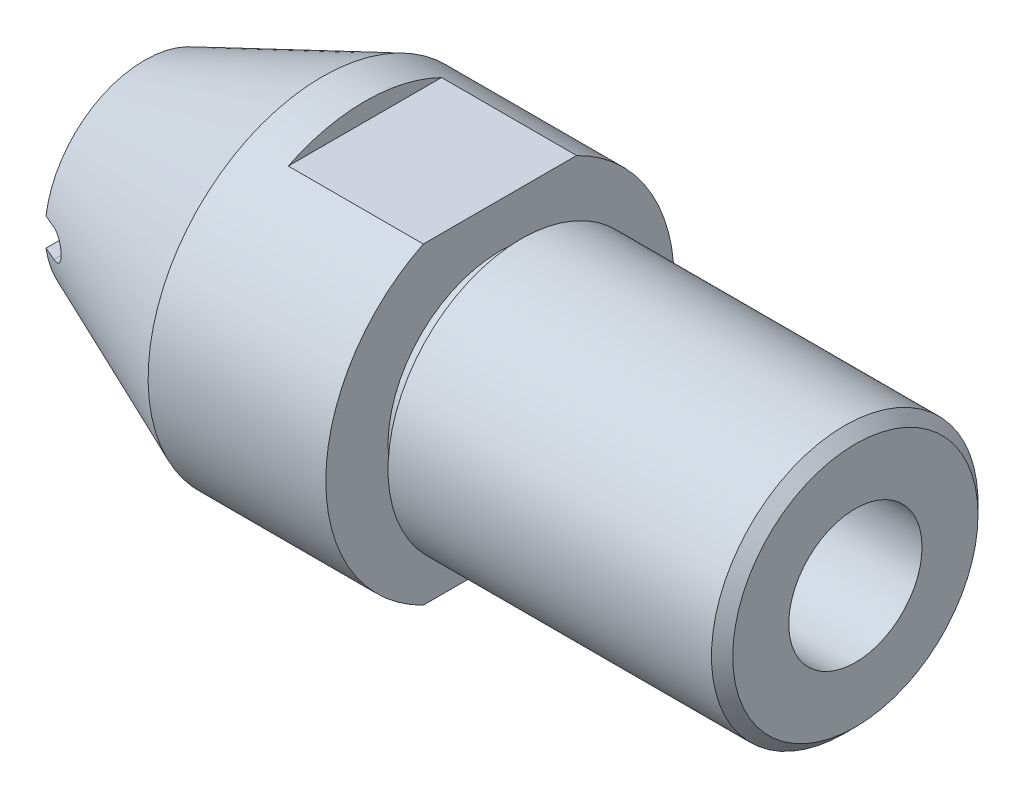
from build123d import *

# Parameters (mm, degrees)
CHAMFER1_SIZE                    = 0.762
F_3_8_0_375_DIAMETER_HOLE1_D     = 9.525
F_3_8_0_375_DIAMETER_HOLE1_DEPTH = 38.1
F_3_8_0_375_DIAMETER_HOLE1_TIP   = 1.733408241
F_3_8_0_375_DIAMETER_HOLE2_D     = 1.524
F_3_8_0_375_DIAMETER_HOLE2_DEPTH = 38.1
F_3_8_0_375_DIAMETER_HOLE2_TIP   = 0.277345319
F_3_8_0_375_DIAMETER_HOLE3_D     = 9.652
F_3_8_0_375_DIAMETER_HOLE3_DEPTH = 4.826
F_3_8_0_375_DIAMETER_HOLE3_TIP   = 1.756520351
EXTRUDE1_DEPTH                   = 25.4
EXTRUDE1_DEPTH_BACK              = 25.4
SKETCH10_W                       = 9.652
SKETCH10_H                       = 2.627899037
SKETCH10_H_2                     = 6.35
CUT_EXTRUDE1_DEPTH               = 12.7


with BuildPart() as part:
    # Sketch1 → Revolve1 (revolve)
    with BuildSketch(Plane.XY):
        Polygon((0, 0), (0, 7.112), (12.7, 12.446), (25.4, 12.446), (25.4, 8.001), (26.924, 8.001), (26.924, 9.525), (50.8, 9.525), (50.8, 0), align=None)
    revolve(axis=Axis((50.8, 0, 0), (-1, 0, 0)))

    # Chamfer1
    chamfer1_edges = [part.edges().sort_by_distance(p)[0] for p in [
        (50.8, -9.525, 0),
    ]]
    chamfer(chamfer1_edges, length=CHAMFER1_SIZE)

    # 3/8 (0.375) Diameter Hole1
    with Locations(Plane(origin=(50.8, 0, 0), x_dir=(0, 0, -1), z_dir=(1, 0, 0))):
        with Locations((0, 0)):
            Hole(F_3_8_0_375_DIAMETER_HOLE1_D / 2, depth=F_3_8_0_375_DIAMETER_HOLE1_DEPTH)
            with Locations((0, 0, -(F_3_8_0_375_DIAMETER_HOLE1_DEPTH + F_3_8_0_375_DIAMETER_HOLE1_TIP / 2))):  # 140° drill point
                Cone(0, F_3_8_0_375_DIAMETER_HOLE1_D / 2, F_3_8_0_375_DIAMETER_HOLE1_TIP, mode=Mode.SUBTRACT)

    # 3/8 (0.375) Diameter Hole2
    with Locations(Plane.ZY):
        with Locations((0, 0)):
            Hole(F_3_8_0_375_DIAMETER_HOLE2_D / 2, depth=F_3_8_0_375_DIAMETER_HOLE2_DEPTH)
            with Locations((0, 0, -(F_3_8_0_375_DIAMETER_HOLE2_DEPTH + F_3_8_0_375_DIAMETER_HOLE2_TIP / 2))):  # 140° drill point
                Cone(0, F_3_8_0_375_DIAMETER_HOLE2_D / 2, F_3_8_0_375_DIAMETER_HOLE2_TIP, mode=Mode.SUBTRACT)

    # 3/8 (0.375) Diameter Hole3
    with Locations(Plane.ZY):
        with Locations((0, 0)):
            Hole(F_3_8_0_375_DIAMETER_HOLE3_D / 2, depth=F_3_8_0_375_DIAMETER_HOLE3_DEPTH)
            with Locations((0, 0, -(F_3_8_0_375_DIAMETER_HOLE3_DEPTH + F_3_8_0_375_DIAMETER_HOLE3_TIP / 2))):  # 140° drill point
                Cone(0, F_3_8_0_375_DIAMETER_HOLE3_D / 2, F_3_8_0_375_DIAMETER_HOLE3_TIP, mode=Mode.SUBTRACT)

    # Sketch10 → Extrude1 (cut, two sides: drawn at the far end of the back side and taken through both)
    with BuildSketch(Plane.XY.offset(-EXTRUDE1_DEPTH_BACK)):
        with Locations((20.574, 12.489949519)):
            Rectangle(SKETCH10_W, SKETCH10_H)
        with Locations((20.574, -14.351)):
            Rectangle(SKETCH10_W, SKETCH10_H_2)
    extrude(amount=EXTRUDE1_DEPTH + EXTRUDE1_DEPTH_BACK, mode=Mode.SUBTRACT)

    # Sketch11 → Cut-Extrude1 (cut, symmetric)
    with BuildSketch(Plane.XY):
        with BuildLine():
            Line((0, 0.9921875), (0, -0.9921875))
            Line((0, -0.9921875), (0.9921875, -0.9921875))
            ThreePointArc((0.9921875, -0.9921875), (1.984375, 0), (0.9921875, 0.9921875))
            Line((0.9921875, 0.9921875), (0, 0.9921875))
        make_face()
    extrude(amount=CUT_EXTRUDE1_DEPTH, both=True, mode=Mode.SUBTRACT)


solid = part.part
